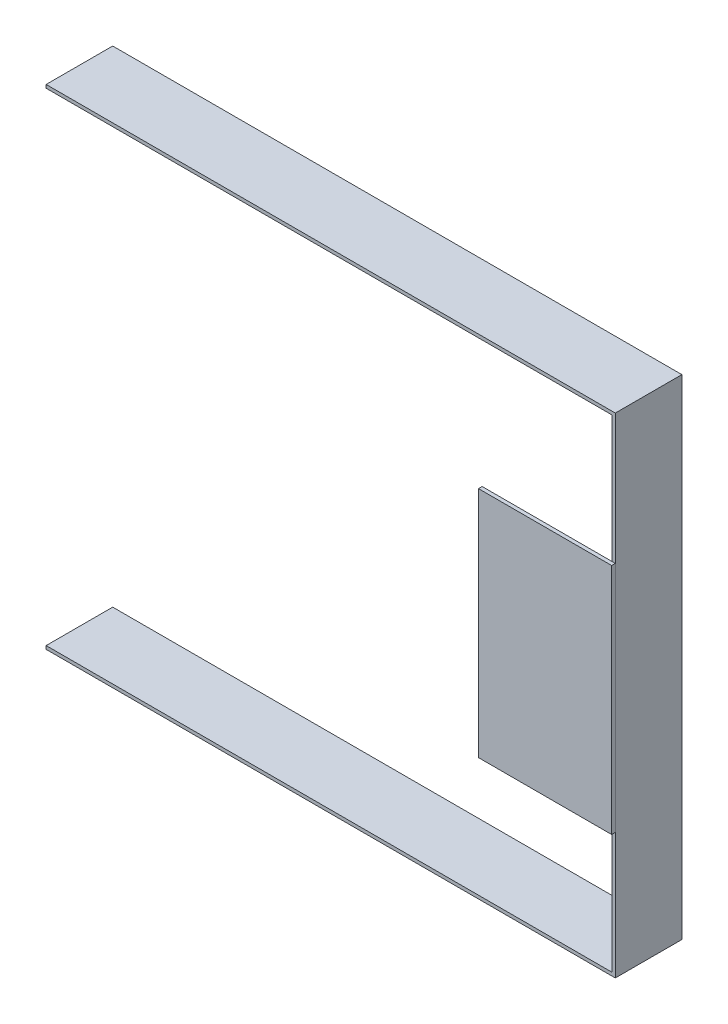
from build123d import *

# Parameters (mm, degrees)
BOSS_EXTRUDE1_DEPTH = 50.8
SKETCH6_W           = 2.794
SKETCH6_H           = 177.8
BOSS_EXTRUDE2_DEPTH = 101.6


with BuildPart() as part:
    # Sketch5 → Boss-Extrude1 (new body)
    with BuildSketch(Plane.XY):
        Polygon((-181.643091349, 42.219202195), (250.156908651, 42.219202195), (250.156908651, -326.080797805), (-181.643091349, -326.080797805), (-181.643091349, -328.620797805), (252.696908651, -328.620797805), (252.696908651, 44.759202195), (-181.643091349, 44.759202195), align=None)
    extrude(amount=BOSS_EXTRUDE1_DEPTH)


with BuildPart() as body_2:
    # Sketch6 → Boss-Extrude2 (new body)
    with BuildSketch(Plane(origin=(252.696908651, 0, 0), x_dir=(0, 0, -1), z_dir=(1, 0, 0))):
        with Locations((-52.197, -143.498449388)):
            Rectangle(SKETCH6_W, SKETCH6_H)
    extrude(amount=-BOSS_EXTRUDE2_DEPTH)


solid = Compound([part.part, body_2.part])
